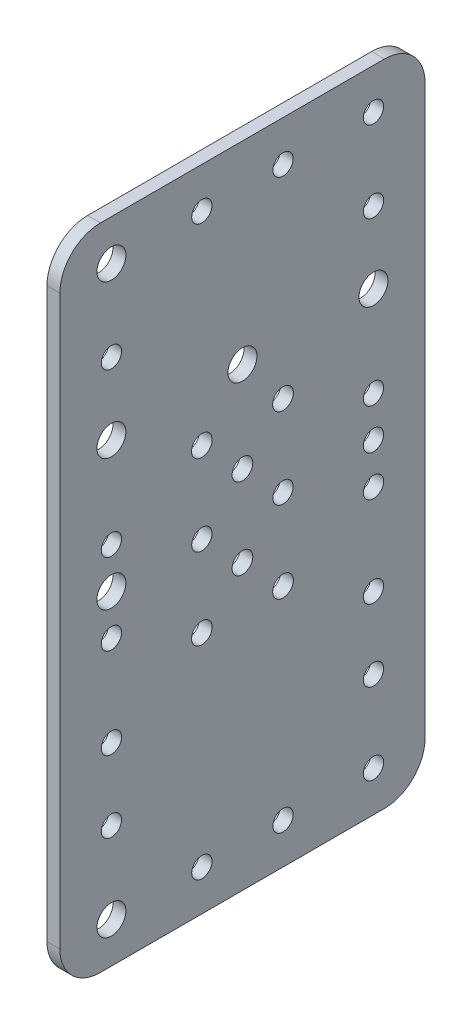
from build123d import *

# Parameters (mm, degrees)
SKETCH1_R           = 2.5
SKETCH1_R_2         = 2.55
SKETCH1_R_3         = 3.5685
BOSS_EXTRUDE1_DEPTH = 3.175


with BuildPart() as part:
    # Sketch1 → Boss-Extrude1 (new body)
    with BuildSketch(Plane(origin=(0, 0, 0), x_dir=(0, -1, 0), z_dir=(-1, 0, 0))):
        with BuildLine():
            Line((-80, 35), (-80, -35))
            ThreePointArc((-80, -35), (-77.071067812, -42.071067812), (-70, -45))
            Line((-70, -45), (70, -45))
            ThreePointArc((70, -45), (77.071067812, -42.071067812), (80, -35))
            Line((80, -35), (80, 35))
            ThreePointArc((80, 35), (77.071067812, 42.071067812), (70, 45))
            Line((70, 45), (-70, 45))
            ThreePointArc((-70, 45), (-77.071067812, 42.071067812), (-80, 35))
        make_face()
        with Locations(Location((50, 32.3, 0), (0, 0, 270))):
            Circle(SKETCH1_R, mode=Mode.SUBTRACT)
        with Locations(Location((50, -32.3, 0), (0, 0, 270))):
            Circle(SKETCH1_R, mode=Mode.SUBTRACT)
        with Locations(Location((-50, 32.3, 0), (0, 0, 270))):
            Circle(SKETCH1_R, mode=Mode.SUBTRACT)
        with Locations(Location((-50, -32.3, 0), (0, 0, 270))):
            Circle(SKETCH1_R, mode=Mode.SUBTRACT)
        with Locations(Location((10, 0, 0), (0, 0, 270))):
            Circle(SKETCH1_R_2, mode=Mode.SUBTRACT)
        with Locations(Location((-10, 0, 0), (0, 0, 270))):
            Circle(SKETCH1_R_2, mode=Mode.SUBTRACT)
        with Locations(Location((-20, 10, 0), (0, 0, 270))):
            Circle(SKETCH1_R_2, mode=Mode.SUBTRACT)
        with Locations(Location((-20, -10, 0), (0, 0, 270))):
            Circle(SKETCH1_R_2, mode=Mode.SUBTRACT)
        with Locations(Location((20, 10, 0), (0, 0, 270))):
            Circle(SKETCH1_R_2, mode=Mode.SUBTRACT)
        with Locations(Location((20, -10, 0), (0, 0, 270))):
            Circle(SKETCH1_R_2, mode=Mode.SUBTRACT)
        with Locations(Location((-70, 10, 0), (0, 0, 270))):
            Circle(SKETCH1_R, mode=Mode.SUBTRACT)
        with Locations(Location((70, 10, 0), (0, 0, 270))):
            Circle(SKETCH1_R, mode=Mode.SUBTRACT)
        with Locations(Location((-70, -10, 0), (0, 0, 270))):
            Circle(SKETCH1_R, mode=Mode.SUBTRACT)
        with Locations(Location((70, -10, 0), (0, 0, 270))):
            Circle(SKETCH1_R, mode=Mode.SUBTRACT)
        with Locations(Location((10, -32.3, 0), (0, 0, 270))):
            Circle(SKETCH1_R, mode=Mode.SUBTRACT)
        with Locations(Location((10, 32.3, 0), (0, 0, 270))):
            Circle(SKETCH1_R, mode=Mode.SUBTRACT)
        with Locations(Location((-10, 32.3, 0), (0, 0, 270))):
            Circle(SKETCH1_R, mode=Mode.SUBTRACT)
        with Locations(Location((-32.3, -32.3, 0), (0, 0, 270))):
            Circle(SKETCH1_R_3, mode=Mode.SUBTRACT)
        with Locations(Location((-32.3, 0, 0), (0, 0, 270))):
            Circle(SKETCH1_R_3, mode=Mode.SUBTRACT)
        with Locations(Location((-32.3, 32.3, 0), (0, 0, 270))):
            Circle(SKETCH1_R_3, mode=Mode.SUBTRACT)
        with Locations(Location((32.3, 32.3, 0), (0, 0, 270))):
            Circle(SKETCH1_R, mode=Mode.SUBTRACT)
        with Locations(Location((32.3, -32.3, 0), (0, 0, 270))):
            Circle(SKETCH1_R, mode=Mode.SUBTRACT)
        with Locations(Location((-10, -32.3, 0), (0, 0, 270))):
            Circle(SKETCH1_R, mode=Mode.SUBTRACT)
        with Locations(Location((0, 10, 0), (0, 0, 270))):
            Circle(SKETCH1_R, mode=Mode.SUBTRACT)
        with Locations(Location((0, -10, 0), (0, 0, 270))):
            Circle(SKETCH1_R, mode=Mode.SUBTRACT)
        with Locations(Location((70, 32.3, 0), (0, 0, 270))):
            Circle(SKETCH1_R_3, mode=Mode.SUBTRACT)
        with Locations(Location((0, 32.3, 0), (0, 0, 270))):
            Circle(SKETCH1_R_3, mode=Mode.SUBTRACT)
        with Locations(Location((-70, 32.3, 0), (0, 0, 270))):
            Circle(SKETCH1_R_3, mode=Mode.SUBTRACT)
        with Locations(Location((-70, -32.3, 0), (0, 0, 270))):
            Circle(SKETCH1_R, mode=Mode.SUBTRACT)
        with Locations(Location((70, -32.3, 0), (0, 0, 270))):
            Circle(SKETCH1_R, mode=Mode.SUBTRACT)
        with Locations(Location((0, -32.3, 0), (0, 0, 270))):
            Circle(SKETCH1_R, mode=Mode.SUBTRACT)
    extrude(amount=-BOSS_EXTRUDE1_DEPTH)


solid = part.part
